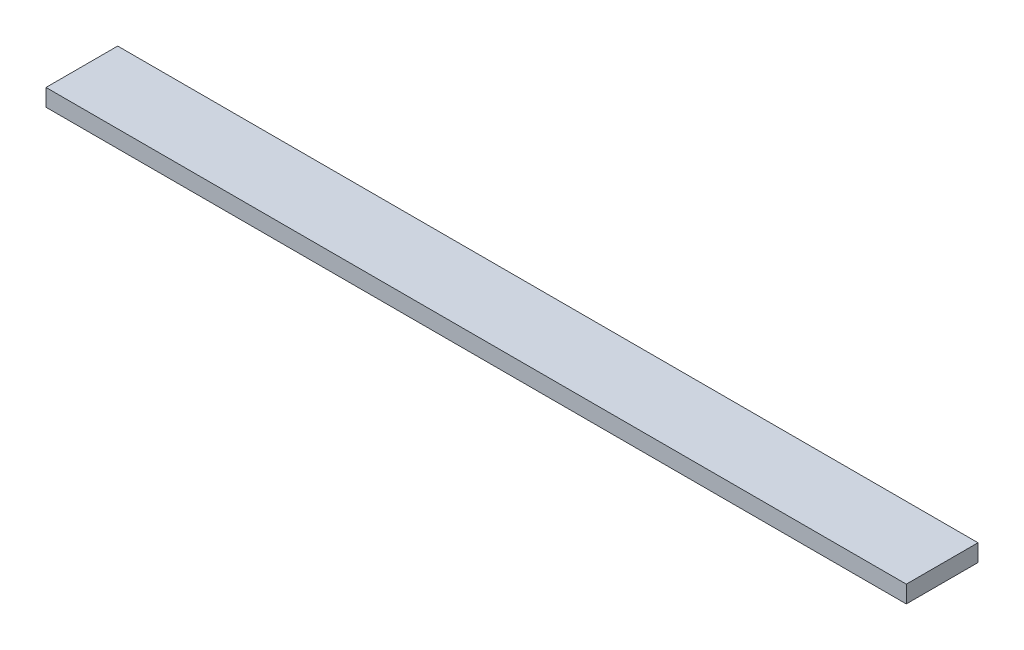
from build123d import *

# Parameters (mm, degrees)
SKETCH1_W           = 914.4
SKETCH1_H           = 76.2
BOSS_EXTRUDE1_DEPTH = 18.25625


with BuildPart() as part:
    # Sketch1 → Boss-Extrude1 (new body)
    with BuildSketch(Plane(origin=(0, 0, 0), x_dir=(1, 0, 0), z_dir=(0, 1, 0))):
        Rectangle(SKETCH1_W, SKETCH1_H)
    extrude(amount=BOSS_EXTRUDE1_DEPTH)


solid = part.part
